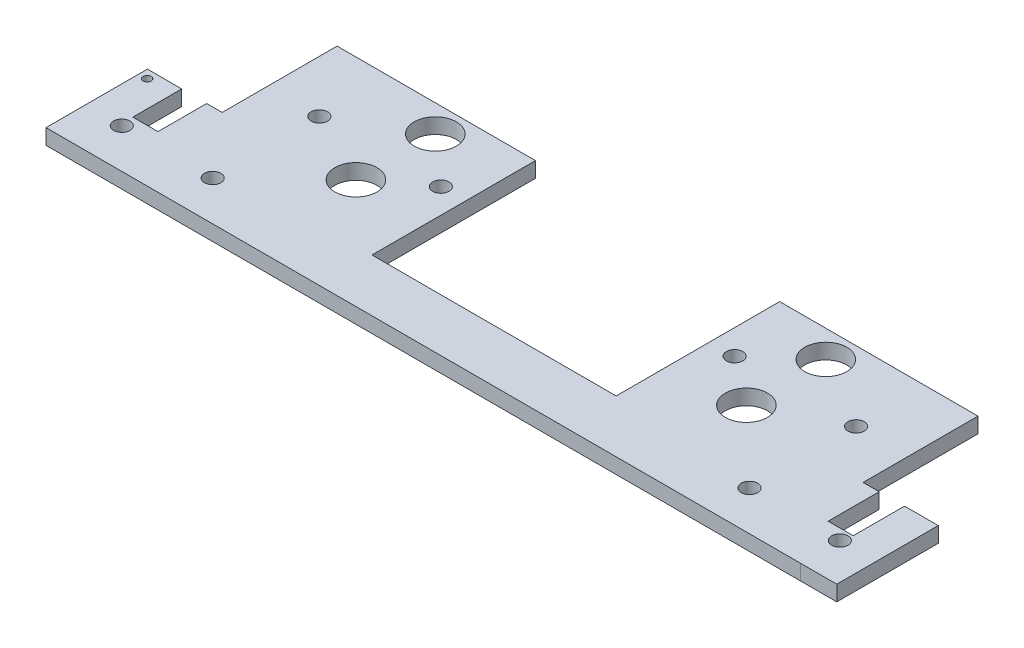
from build123d import *

# Parameters (mm, degrees)
SKETCH1_R           = 0.8382
SKETCH1_R_2         = 2.159
BOSS_EXTRUDE1_DEPTH = 1.575
SKETCH2_W           = 86.242658642
SKETCH2_H           = 6.602
CUT_EXTRUDE1_DEPTH  = 65.362755899
CUT_EXTRUDE2_DEPTH  = 60.755092082
CUT_EXTRUDE3_DEPTH  = 60.755092082
SKETCH6_R           = 0.8382
CUT_EXTRUDE4_DEPTH  = 2.54
SKETCH7_W           = 65.648
SKETCH7_H           = 7.5
CUT_EXTRUDE5_DEPTH  = 58.2054366
SKETCH11_R          = 0.412551942
ID_HOLE_DEPTH       = 58.2054366
SKETCH12_W          = 2.575
SKETCH12_H          = 5
CUT_EXTRUDE6_DEPTH  = 58.2054366
SKETCH14_W          = 2.575
SKETCH14_H          = 17.002619879
CUT_EXTRUDE7_DEPTH  = 58.2054366


with BuildPart() as part:
    # Sketch1 → Boss-Extrude1 (new body)
    with BuildSketch(Plane(origin=(0, 0, 0), x_dir=(1, 0, 0), z_dir=(0, 1, 0))):
        Polygon((44.351293299, -40.014412246), (37.136293299, -40.014412246), (37.136293299, -46.615946892), (29.968293307, -46.615946892), (-30.083706693, -46.615946892), (-36.433706701, -46.615946892), (-36.433706701, -40.014412246), (-43.648706701, -40.014412246), (-43.648706701, -30.885946892), (-43.648706701, -29.647946892), (-42.378706693, -29.615946892), (-32.472706701, -29.647946892), (-32.472706701, -10.370428445), (-12.155556701, -10.370428445), (-12.155556701, -34.615947016), (-11.557706701, -34.615947016), (12.260293299, -34.615947016), (12.858143299, -34.615947016), (12.858143299, -10.370428445), (33.175293299, -10.370428445), (33.175293299, -12.929386892), (33.175293299, -29.647946892), (38.746293307, -29.615946892), (42.351293307, -29.615946892), (44.351293299, -29.615946892), (44.351293299, -31.651946892), align=None)
        with Locations(Location((-36.433706701, -35.965946892, 0), (0, 0, 270))):
            Circle(SKETCH1_R, mode=Mode.SUBTRACT)
        with Locations(Location((37.136293299, -35.983946892, 0), (0, 0, 270))):
            Circle(SKETCH1_R, mode=Mode.SUBTRACT)
        with Locations(Location((-19.648556701, -28.76738335, 0), (0, 0, 270))):
            Circle(SKETCH1_R_2, mode=Mode.SUBTRACT)
        with Locations(Location((-19.648556701, -20.63938335, 0), (0, 0, 270))):
            Circle(SKETCH1_R_2, mode=Mode.SUBTRACT)
        with Locations(Location((20.351397299, -20.63938335, 0), (0, 0, 270))):
            Circle(SKETCH1_R_2, mode=Mode.SUBTRACT)
        with Locations(Location((20.351397299, -28.76738335, 0), (0, 0, 270))):
            Circle(SKETCH1_R_2, mode=Mode.SUBTRACT)
    extrude(amount=BOSS_EXTRUDE1_DEPTH)

    # Sketch2 → Cut-Extrude1 (cut, through all)
    with BuildSketch(Plane.XZ):
        with Locations((-5.985036022, 43.314946892)):
            Rectangle(SKETCH2_W, SKETCH2_H)
    extrude(amount=-CUT_EXTRUDE1_DEPTH, mode=Mode.SUBTRACT)

    # Sketch3 → Cut-Extrude2 (cut, through all)
    with BuildSketch(Plane.XZ):
        Polygon((-40.148706701, 40.013946892), (-40.148706701, 29.623150607), (-34.773706693, 29.640513821), (-34.773706693, 8.975624969), (-46.772834391, 8.975624969), (-46.772834391, 40.013946892), align=None)
    extrude(amount=-CUT_EXTRUDE2_DEPTH, mode=Mode.SUBTRACT)

    # Sketch4 → Cut-Extrude3 (cut, through all)
    with BuildSketch(Plane.XZ):
        Polygon((40.851293299, 40.014412246), (40.851293299, 32.420104455), (40.851293299, 29.615946892), (35.476293307, 29.615946892), (35.476293307, 10.370428445), (54.710892309, 10.370428445), (54.710892309, 40.014412246), align=None)
    extrude(amount=-CUT_EXTRUDE3_DEPTH, mode=Mode.SUBTRACT)

    # Sketch6 → Cut-Extrude4 (cut)
    with BuildSketch(Plane(origin=(0, 0, 0), x_dir=(-1, 0, 0), z_dir=(0, -1, 0))):
        with Locations(Location((27.141556701, -35.947946892, 0), (0, 0, 90))):
            Circle(SKETCH6_R)
        with Locations(Location((27.141556701, -25.025946892, 0), (0, 0, 90))):
            Circle(SKETCH6_R)
        with Locations(Location((14.695556701, -25.025946892, 0), (0, 0, 90))):
            Circle(SKETCH6_R)
        with Locations(Location((-15.398143299, -25.025946892, 0), (0, 0, 90))):
            Circle(SKETCH6_R)
        with Locations(Location((-27.844397299, -25.025946892, 0), (0, 0, 90))):
            Circle(SKETCH6_R)
        with Locations(Location((-27.844397299, -35.947946892, 0), (0, 0, 90))):
            Circle(SKETCH6_R)
    extrude(amount=-CUT_EXTRUDE4_DEPTH, mode=Mode.SUBTRACT)

    # Sketch7 → Cut-Extrude5 (cut, through all)
    with BuildSketch(Plane.XZ):
        with Locations((0.351293299, 14.120428445)):
            Rectangle(SKETCH7_W, SKETCH7_H)
    extrude(amount=-CUT_EXTRUDE5_DEPTH, mode=Mode.SUBTRACT)

    # Sketch11 → ID HOLE (cut, through all)
    with BuildSketch(Plane(origin=(0, 1.575, 0), x_dir=(1, 0, 0), z_dir=(0, 1, 0))):
        with Locations(Location((-39.304798754, -30.495020326, 0), (0, 0, 270))):
            Circle(SKETCH11_R)
    extrude(amount=-ID_HOLE_DEPTH, mode=Mode.SUBTRACT)

    # Sketch12 → Cut-Extrude6 (cut, through all)
    with BuildSketch(Plane(origin=(0, 0, 0), x_dir=(-1, 0, 0), z_dir=(0, -1, 0))):
        with Locations((35.345206701, -32.134508572)):
            Rectangle(SKETCH12_W, SKETCH12_H)
    extrude(amount=-CUT_EXTRUDE6_DEPTH, mode=Mode.SUBTRACT)

    # Sketch14 → Cut-Extrude7 (cut, through all)
    with BuildSketch(Plane(origin=(0, 0, 0), x_dir=(-1, 0, 0), z_dir=(0, -1, 0))):
        with Locations((-36.109793299, -26.371738385)):
            Rectangle(SKETCH14_W, SKETCH14_H)
    extrude(amount=-CUT_EXTRUDE7_DEPTH, mode=Mode.SUBTRACT)


solid = part.part
